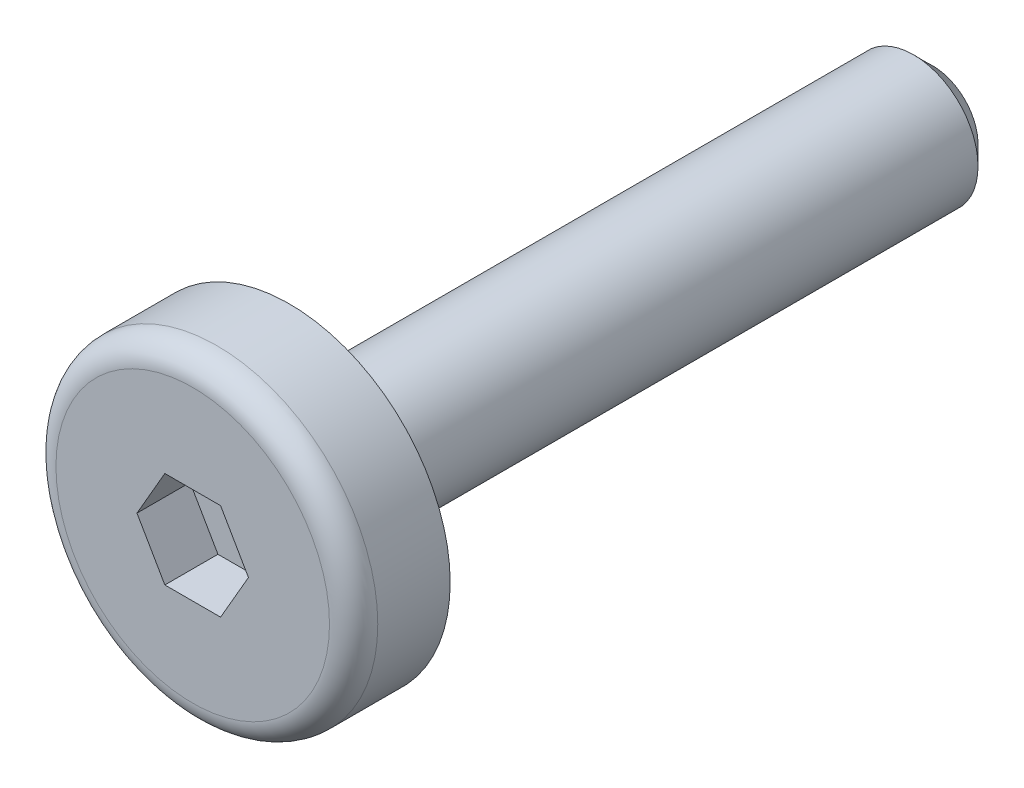
from build123d import *

# Parameters (mm, degrees)
SHANK_TIP_CHAMFER_SIZE = 0.3
PAN_HEAD_ROUND_R       = 0.375
HEX_DRIVE_CUT_DEPTH    = 0.825


with BuildPart() as part:
    # Screw Section → Screw Blank Revolve (revolve)
    with BuildSketch(Plane(origin=(0, 0, 0), x_dir=(1, 0, 0), z_dir=(0, 1, 0))):
        Polygon((0, 10), (1, 10), (1, 0), (2.5, 0), (2.5, -1.5), (0, -1.5), align=None)
    revolve(axis=Axis((0, 0, 10.123), (0, 0, -1)))

    # Shank Tip Chamfer
    shank_tip_chamfer_edges = [part.edges().sort_by_distance(p)[0] for p in [
        (-1, 0, -10),
    ]]
    chamfer(shank_tip_chamfer_edges, length=SHANK_TIP_CHAMFER_SIZE)

    # Pan Head Round
    pan_head_round_edges = [part.edges().sort_by_distance(p)[0] for p in [
        (-2.5, 0, 1.5),
    ]]
    fillet(pan_head_round_edges, radius=PAN_HEAD_ROUND_R)

    # Hex Drive Sketch → Hex Drive Cut (cut)
    with BuildSketch(Plane.XY.offset(1.5)):
        Polygon((0.866025404, 0), (0.433012702, 0.75), (-0.433012702, 0.75), (-0.866025404, 0), (-0.433012702, -0.75), (0.433012702, -0.75), align=None)
    extrude(amount=-HEX_DRIVE_CUT_DEPTH, mode=Mode.SUBTRACT)


solid = part.part
